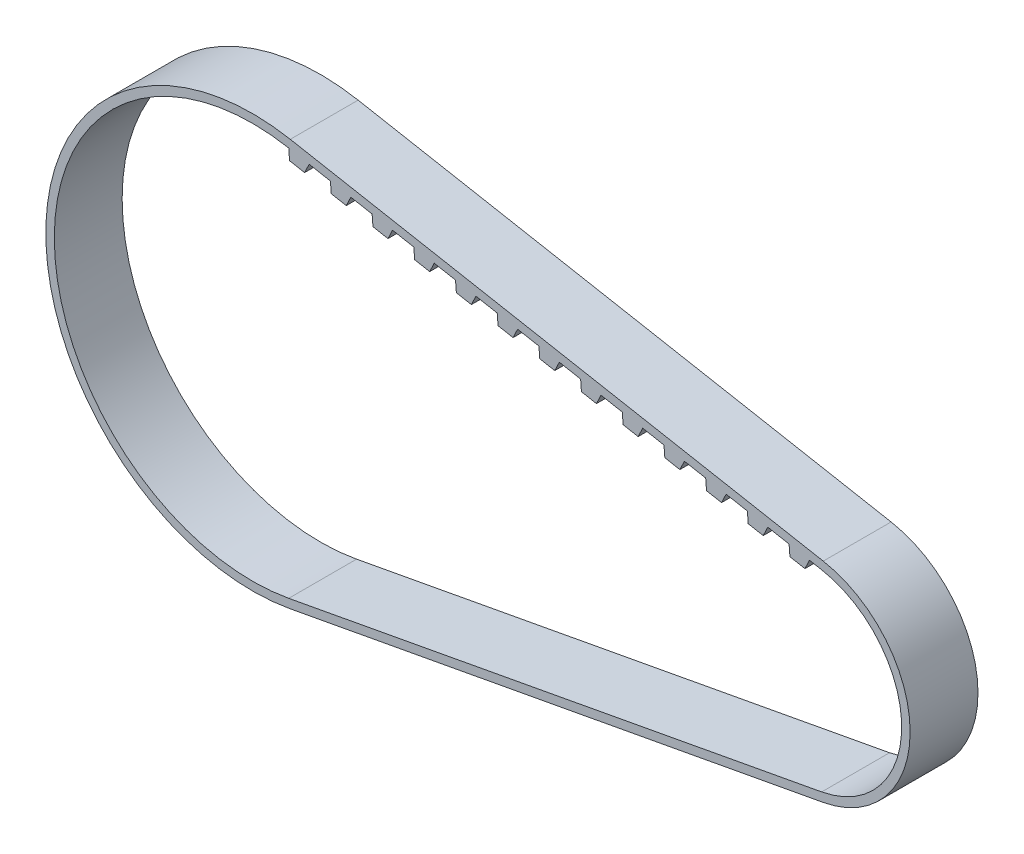
from build123d import *

# Parameters (mm, degrees)
BOSS_EXTRUDE1_DEPTH = 8
BOSS_EXTRUDE2_DEPTH = 8
CRVPATTERN1_COUNT   = 48
CRVPATTERN1_PITCH   = 5


with BuildPart() as part:
    # Sketch2 → Boss-Extrude1 (new body)
    with BuildSketch(Plane.XY):
        with BuildLine():
            Line((67.284315385, 12.320016365), (4.444661538, 23.971428489))
            ThreePointArc((4.444661538, 23.971428489), (-24.38, 0), (4.444661538, -23.971428489))
            Line((4.444661538, -23.971428489), (67.284315385, -12.320016365))
            ThreePointArc((67.284315385, -12.320016365), (77.53, 0), (67.284315385, 12.320016365))
        make_face()
        with BuildLine():
            Line((4.262353846, -22.98818696), (67.102007692, -11.336774835))
            ThreePointArc((67.102007692, -11.336774835), (76.53, 0), (67.102007692, 11.336774835))
            Line((67.102007692, 11.336774835), (4.262353846, 22.98818696))
            ThreePointArc((4.262353846, 22.98818696), (-23.38, 0), (4.262353846, -22.98818696))
        make_face(mode=Mode.SUBTRACT)
    extrude(amount=BOSS_EXTRUDE1_DEPTH)

    # Sketch4 → Boss-Extrude2 (add)
    with BuildSketch(Plane.XY):
        Polygon((4.262353846, 22.98818696), (4.360336253, 21.742033098), (6.130171006, 21.413879251), (6.668392684, 22.542071356), align=None)
    boss_extrude2 = extrude(amount=BOSS_EXTRUDE2_DEPTH)

    # CrvPattern1: Boss-Extrude2 ×48, 35 skipped
    with Locations(*[Vector(0.9832415295345763, -0.18230769209911846, 0) * (i * CRVPATTERN1_PITCH) for i in range(1, CRVPATTERN1_COUNT) if i not in (13, 14, 15, 16, 17, 18, 19, 20, 21, 22, 23, 24, 25, 26, 27, 28, 29, 30, 31, 32, 33, 34, 35, 36, 37, 38, 39, 40, 41, 42, 43, 44, 45, 46, 47)]):
        add(boss_extrude2)


solid = part.part
